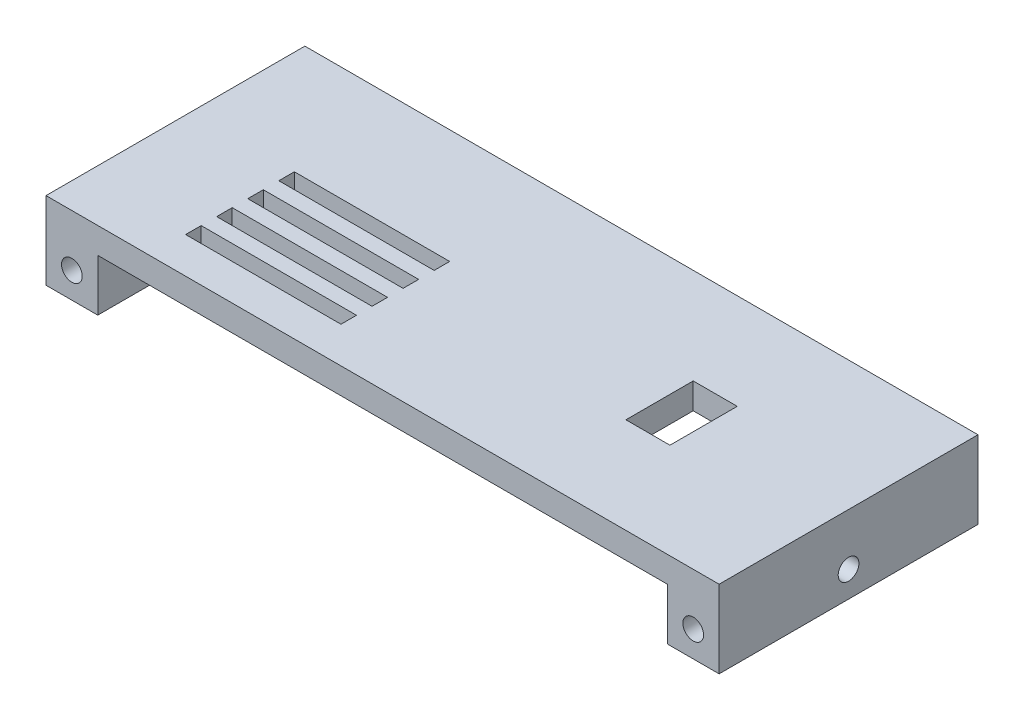
from build123d import *

# Parameters (mm, degrees)
ESBO_O1_W                = 130
ESBO_O1_H                = 50
RESSALTO_EXTRUS_O1_DEPTH = 15
ESBO_O2_W                = 110
ESBO_O2_H                = 10
CORTE_EXTRUS_O1_DEPTH    = 51
ESBO_O12_R               = 2
CORTE_EXTRUS_O8_DEPTH    = 10
CORTE_EXTRUS_O9_START    = -10
ESBO_O14_R               = 2
CORTE_EXTRUS_O9_DEPTH    = 10
ESBO_O7_R                = 2
CORTE_EXTRUS_O11_DEPTH   = 10
CORTE_EXTRUS_O12_START   = -10
ESBO_O6_R                = 2
CORTE_EXTRUS_O12_DEPTH   = 10
ESBO_O23_W               = 8.5
ESBO_O23_H               = 13
CORTE_EXTRUS_O13_DEPTH   = 10
ESBO_O20_W               = 30
ESBO_O20_H               = 3
CORTE_EXTRUS_O14_DEPTH   = 10


with BuildPart() as part:
    # Esboço1 → Ressalto-extrusão1 (new body)
    with BuildSketch(Plane(origin=(0, 0, 0), x_dir=(1, 0, 0), z_dir=(0, 1, 0))):
        with Locations((-65, 25)):
            Rectangle(ESBO_O1_W, ESBO_O1_H)
    extrude(amount=RESSALTO_EXTRUS_O1_DEPTH)

    # Esboço2 → Corte-extrusão1 (cut)
    with BuildSketch(Plane(origin=(0, 0, -50), x_dir=(-1, 0, 0), z_dir=(0, 0, -1))):
        with Locations((65, 5)):
            Rectangle(ESBO_O2_W, ESBO_O2_H)
    extrude(amount=-CORTE_EXTRUS_O1_DEPTH, mode=Mode.SUBTRACT)

    # Esboço12 → Corte-extrusão8 (cut)
    with BuildSketch(Plane(origin=(0, 0, 0), x_dir=(0, 0, -1), z_dir=(1, 0, 0))):
        with Locations((25, 5)):
            Circle(ESBO_O12_R)
    extrude(amount=-CORTE_EXTRUS_O8_DEPTH, mode=Mode.SUBTRACT)

    # Esboço14 → Corte-extrusão9 (cut)
    with BuildSketch(Plane.ZY.offset(130).offset(CORTE_EXTRUS_O9_START)):
        with Locations(Location((-25, 5, 0), (0, 0, 180))):
            Circle(ESBO_O14_R)
    extrude(amount=CORTE_EXTRUS_O9_DEPTH, mode=Mode.SUBTRACT)

    # Esboço7 → Corte-extrusão11 (cut)
    with BuildSketch(Plane.XY):
        with Locations((-5, 5)):
            Circle(ESBO_O7_R)
        with Locations((-125, 5)):
            Circle(ESBO_O7_R)
    extrude(amount=-CORTE_EXTRUS_O11_DEPTH, mode=Mode.SUBTRACT)

    # Esboço6 → Corte-extrusão12 (cut)
    with BuildSketch(Plane(origin=(0, 0, -50), x_dir=(-1, 0, 0), z_dir=(0, 0, -1)).offset(CORTE_EXTRUS_O12_START)):
        with Locations(Location((5, 5, 0), (0, 0, 180))):
            Circle(ESBO_O6_R)
        with Locations(Location((125, 5, 0), (0, 0, 180))):
            Circle(ESBO_O6_R)
    extrude(amount=CORTE_EXTRUS_O12_DEPTH, mode=Mode.SUBTRACT)

    # Esboço23 → Corte-extrusão13 (cut)
    with BuildSketch(Plane(origin=(0, 15, 0), x_dir=(1, 0, 0), z_dir=(0, 1, 0))):
        with Locations((-32.25, 25)):
            Rectangle(ESBO_O23_W, ESBO_O23_H)
    extrude(amount=-CORTE_EXTRUS_O13_DEPTH, mode=Mode.SUBTRACT)

    # Esboço20 → Corte-extrusão14 (cut)
    with BuildSketch(Plane(origin=(0, 15, 0), x_dir=(1, 0, 0), z_dir=(0, 1, 0))):
        with Locations((-95, 20.466517667)):
            Rectangle(ESBO_O20_W, ESBO_O20_H)
        with Locations((-95, 8.466517667)):
            Rectangle(ESBO_O20_W, ESBO_O20_H)
        with Locations((-95, 26.466517667)):
            Rectangle(ESBO_O20_W, ESBO_O20_H)
        with Locations((-95, 14.466517667)):
            Rectangle(ESBO_O20_W, ESBO_O20_H)
    extrude(amount=-CORTE_EXTRUS_O14_DEPTH, mode=Mode.SUBTRACT)


solid = part.part
